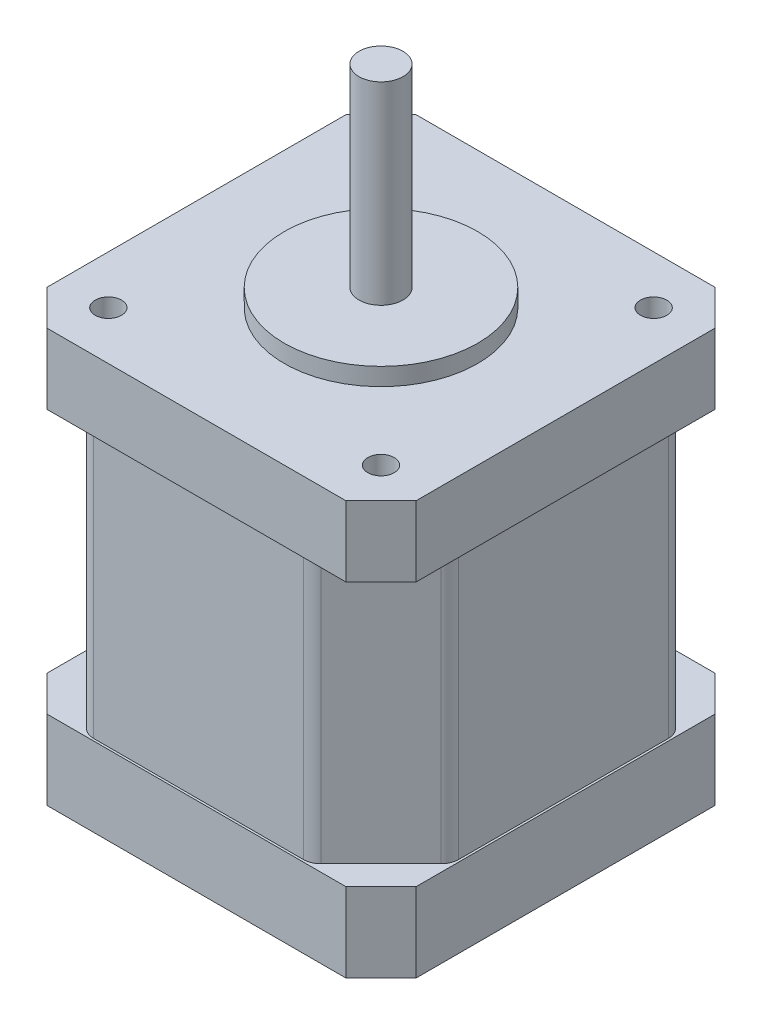
from build123d import *

# Parameters (mm, degrees)
SKETCH1_R           = 1.5
BOSS_EXTRUDE1_DEPTH = 8
BOSS_EXTRUDE2_DEPTH = 30
FILLET1_R           = 2
BOSS_EXTRUDE3_DEPTH = 9
SKETCH4_R           = 11
BOSS_EXTRUDE4_DEPTH = 2
SKETCH5_R           = 2.5
BOSS_EXTRUDE5_DEPTH = 22


with BuildPart() as part:
    # Sketch1 → Boss-Extrude1 (new body)
    with BuildSketch(Plane(origin=(0, 0, 0), x_dir=(1, 0, 0), z_dir=(0, 1, 0))):
        Polygon((-17, 21), (17, 21), (21, 17), (21, -17), (17, -21), (-17, -21), (-21, -17), (-21, 17), align=None)
        with Locations(Location((-15.5, 15.5, 0), (0, 0, 270))):
            Circle(SKETCH1_R, mode=Mode.SUBTRACT)
        with Locations(Location((-15.5, -15.5, 0), (0, 0, 270))):
            Circle(SKETCH1_R, mode=Mode.SUBTRACT)
        with Locations(Location((15.5, -15.5, 0), (0, 0, 270))):
            Circle(SKETCH1_R, mode=Mode.SUBTRACT)
        with Locations(Location((15.5, 15.5, 0), (0, 0, 270))):
            Circle(SKETCH1_R, mode=Mode.SUBTRACT)
    extrude(amount=BOSS_EXTRUDE1_DEPTH)

    # Sketch2 → Boss-Extrude2 (add)
    with BuildSketch(Plane.XZ):
        Polygon((-12.75, 20.75), (12.75, 20.75), (20.75, 12.75), (20.75, -12.75), (12.75, -20.75), (-12.75, -20.75), (-20.75, -12.75), (-20.75, 12.75), align=None)
    extrude(amount=BOSS_EXTRUDE2_DEPTH)

    # Fillet1
    fillet1_edges = [part.edges().sort_by_distance(p)[0] for p in [
        (20.75, -15, 12.75),
        (12.75, -15, 20.75),
        (-12.75, -15, 20.75),
        (-20.75, -15, 12.75),
        (-20.75, -15, -12.75),
        (-12.75, -15, -20.75),
        (12.75, -15, -20.75),
        (20.75, -15, -12.75),
    ]]
    fillet(fillet1_edges, radius=FILLET1_R)

    # Sketch3 → Boss-Extrude3 (add)
    with BuildSketch(Plane.XZ.offset(30)):
        Polygon((-21, 17), (-21, -17), (-17, -21), (17, -21), (21, -17), (21, 17), (17, 21), (-17, 21), align=None)
    extrude(amount=BOSS_EXTRUDE3_DEPTH)

    # Sketch4 → Boss-Extrude4 (add)
    with BuildSketch(Plane(origin=(0, 8, 0), x_dir=(1, 0, 0), z_dir=(0, 1, 0))):
        with Locations(Location((0, 0, 0), (0, 0, 90))):
            Circle(SKETCH4_R)
    extrude(amount=BOSS_EXTRUDE4_DEPTH)

    # Sketch5 → Boss-Extrude5 (add)
    with BuildSketch(Plane(origin=(0, 10, 0), x_dir=(1, 0, 0), z_dir=(0, 1, 0))):
        with Locations(Location((0, 0, 0), (0, 0, 270))):
            Circle(SKETCH5_R)
    extrude(amount=BOSS_EXTRUDE5_DEPTH)


solid = part.part
